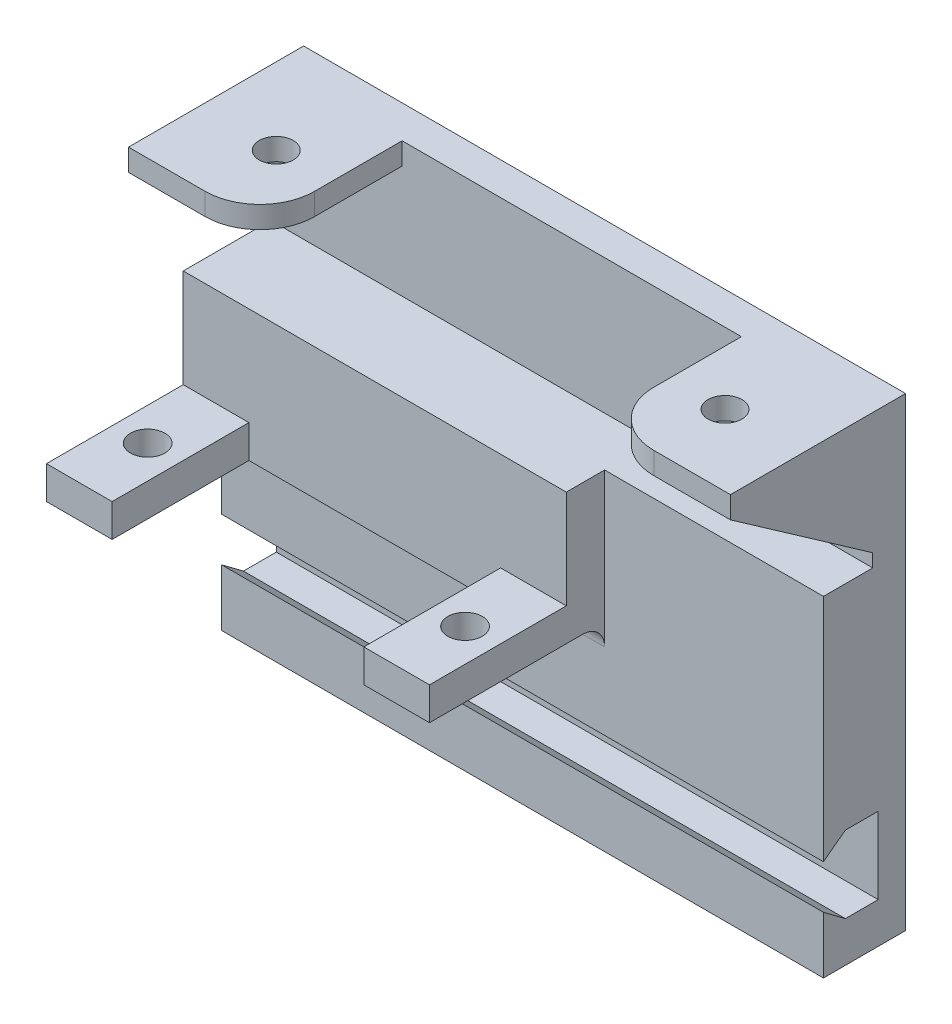
from build123d import *

# Parameters (mm, degrees)
SKETCH1_W               = 55
SKETCH1_H               = 42.5
BOSS_EXTRUDE1_DEPTH     = 23.5
CUT_EXTRUDE1_DEPTH      = 64.4729273
CUT_EXTRUDE1_DEPTH_BACK = 64.4729273
CUT_EXTRUDE2_DEPTH      = 42.953098813
CUT_EXTRUDE2_DEPTH_BACK = 42.953098813
CUT_EXTRUDE3_DEPTH      = 42.953098813
CUT_EXTRUDE3_DEPTH_BACK = 42.953098813
SKETCH4_W               = 23
SKETCH4_H               = 12.5
CUT_EXTRUDE4_DEPTH      = 42.978446851
CUT_EXTRUDE4_DEPTH_BACK = 42.978446851
SKETCH5_R               = 1.575
BOSS_EXTRUDE2_DEPTH     = 2
BOSS_EXTRUDE3_DEPTH     = 2
BOSS_EXTRUDE4_DEPTH     = 2
SKETCH11_R              = 1.55
CUT_EXTRUDE5_DEPTH      = 2


with BuildPart() as part:
    # Sketch1 → Boss-Extrude1 (new body)
    with BuildSketch(Plane.XY):
        Rectangle(SKETCH1_W, SKETCH1_H)
    extrude(amount=BOSS_EXTRUDE1_DEPTH)

    # Sketch2 → Cut-Extrude1 (cut, two sides: drawn at the far end of the back side and taken through both)
    with BuildSketch(Plane(origin=(27.5, 0, 0), x_dir=(0, 0, -1), z_dir=(1, 0, 0)).offset(-CUT_EXTRUDE1_DEPTH_BACK)):
        with BuildLine():
            Line((-3, 21.25), (-3, 8.95))
            Line((-3, 8.95), (-11, 8.95))
            Line((-11, 8.95), (-11, -0.05))
            Line((-11, -0.05), (-23.5, -0.05))
            Line((-23.5, -0.05), (-23.5, -3.05))
            Line((-23.5, -3.05), (-9.5, -3.05))
            ThreePointArc((-9.5, -3.05), (-8.085786438, -3.635786438), (-7.5, -5.05))
            Line((-7.5, -5.05), (-7.5, -12.05))
            Line((-7.5, -12.05), (-5.5, -10.55))
            Line((-5.5, -10.55), (-2.5, -10.55))
            Line((-2.5, -10.55), (-2.5, -17.55))
            Line((-2.5, -17.55), (-5.5, -17.55))
            Line((-5.5, -17.55), (-7.5, -16.05))
            Line((-7.5, -16.05), (-7.5, -21.25))
            Line((-7.5, -21.25), (-33.241676539, -21.25))
            Line((-33.241676539, -21.25), (-33.241676539, 21.25))
            Line((-33.241676539, 21.25), (-3, 21.25))
        make_face()
    extrude(amount=CUT_EXTRUDE1_DEPTH + CUT_EXTRUDE1_DEPTH_BACK, mode=Mode.SUBTRACT)

    # Sketch3 → Cut-Extrude2 (cut, two sides: drawn at the far end of the back side and taken through both)
    with BuildSketch(Plane(origin=(0, 0, 0), x_dir=(1, 0, 0), z_dir=(0, 1, 0)).offset(-CUT_EXTRUDE2_DEPTH_BACK)):
        Polygon((7.5, -10.995887084), (7.5, -23.5), (27.5, -23.5), (27.5, -10.993542952), (27.5, -7.5), (7.5, -7.5), align=None)
    extrude(amount=CUT_EXTRUDE2_DEPTH + CUT_EXTRUDE2_DEPTH_BACK, mode=Mode.SUBTRACT)

    # Sketch4 → Cut-Extrude3 (cut, two sides: drawn at the far end of the back side and taken through both)
    with BuildSketch(Plane(origin=(0, 0, 0), x_dir=(1, 0, 0), z_dir=(0, 1, 0)).offset(-CUT_EXTRUDE3_DEPTH_BACK)):
        with Locations((-10, -17.25)):
            Rectangle(SKETCH4_W, SKETCH4_H)
    extrude(amount=CUT_EXTRUDE3_DEPTH + CUT_EXTRUDE3_DEPTH_BACK, mode=Mode.SUBTRACT)

    # Sketch5 → Cut-Extrude4 (cut, two sides: drawn at the far end of the back side and taken through both)
    with BuildSketch(Plane(origin=(0, -0.05, 0), x_dir=(1, 0, 0), z_dir=(0, 1, 0)).offset(-CUT_EXTRUDE4_DEPTH_BACK)):
        with Locations(Location((-24.5, -17.25, 0), (0, 0, 270))):
            Circle(SKETCH5_R)
        with Locations(Location((4.5, -17.25, 0), (0, 0, 270))):
            Circle(SKETCH5_R)
    extrude(amount=CUT_EXTRUDE4_DEPTH + CUT_EXTRUDE4_DEPTH_BACK, mode=Mode.SUBTRACT)

    # Sketch6 → Boss-Extrude2 (add)
    with BuildSketch(Plane(origin=(0, 21.25, 0), x_dir=(1, 0, 0), z_dir=(0, 1, 0))):
        with BuildLine():
            Line((-27.5, -3), (-27.5, -16))
            Line((-27.5, -16), (-20.5, -16))
            ThreePointArc((-20.5, -16), (-16.964466094, -14.535533906), (-15.5, -11))
            Line((-15.5, -11), (-15.5, -3))
            Line((-15.5, -3), (-27.5, -3))
        make_face()
        with BuildLine():
            Line((15.5, -3), (27.5, -3))
            Line((27.5, -3), (27.5, -16))
            Line((27.5, -16), (20.5, -16))
            ThreePointArc((20.5, -16), (16.964466094, -14.535533906), (15.5, -11))
            Line((15.5, -11), (15.5, -3))
        make_face()
    extrude(amount=-BOSS_EXTRUDE2_DEPTH)

    # Sketch7 → Boss-Extrude3 (add)
    with BuildSketch(Plane(origin=(27.5, 0, 0), x_dir=(0, 0, -1), z_dir=(1, 0, 0))):
        Polygon((-3, 19.25), (-3, 10.150500969), (-16, 19.25), align=None)
    extrude(amount=-BOSS_EXTRUDE3_DEPTH)

    # Sketch9 → Boss-Extrude4 (add)
    with BuildSketch(Plane.ZY.offset(27.5)):
        Polygon((16, 19.25), (3, 10.150500969), (3, 19.25), align=None)
    extrude(amount=-BOSS_EXTRUDE4_DEPTH)

    # Sketch11 → Cut-Extrude5 (cut)
    with BuildSketch(Plane(origin=(0, 21.25, 0), x_dir=(1, 0, 0), z_dir=(0, 1, 0))):
        with Locations(Location((-20.5, -9.5, 0), (0, 0, 180))):
            Circle(SKETCH11_R)
        with Locations(Location((20.5, -9.5, 0), (0, 0, 180))):
            Circle(SKETCH11_R)
    extrude(amount=-CUT_EXTRUDE5_DEPTH, mode=Mode.SUBTRACT)


solid = part.part
